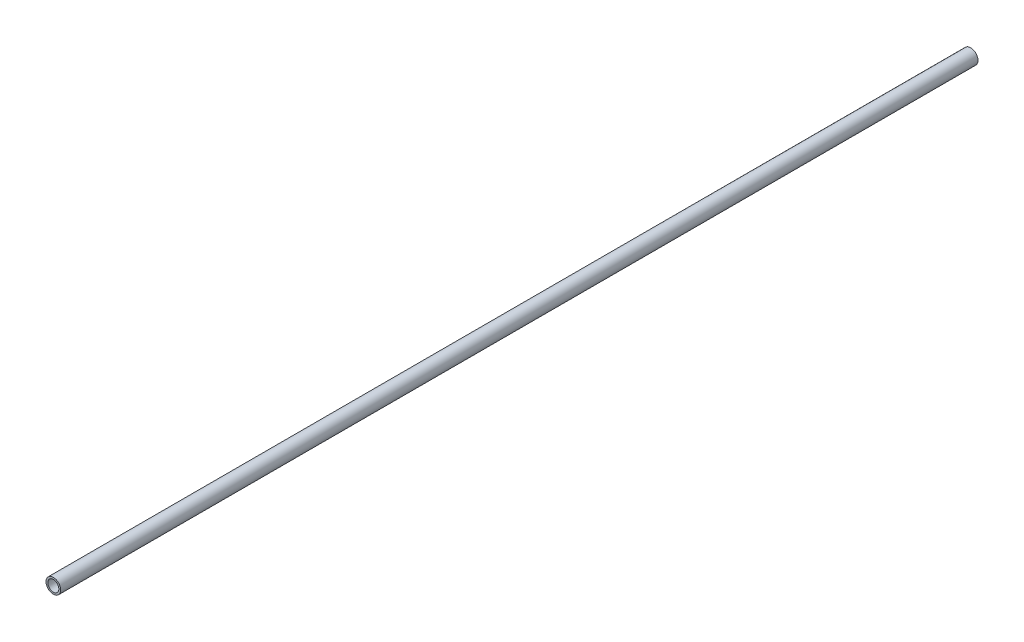
from build123d import *

# Parameters (mm, degrees)
SKETCH2_R           = 4
SKETCH2_R_2         = 3
BOSS_EXTRUDE1_DEPTH = 500


with BuildPart() as part:
    # Sketch2 → Boss-Extrude1 (new body)
    with BuildSketch(Plane.XY):
        Circle(SKETCH2_R)
        Circle(SKETCH2_R_2, mode=Mode.SUBTRACT)
    extrude(amount=BOSS_EXTRUDE1_DEPTH)


solid = part.part
